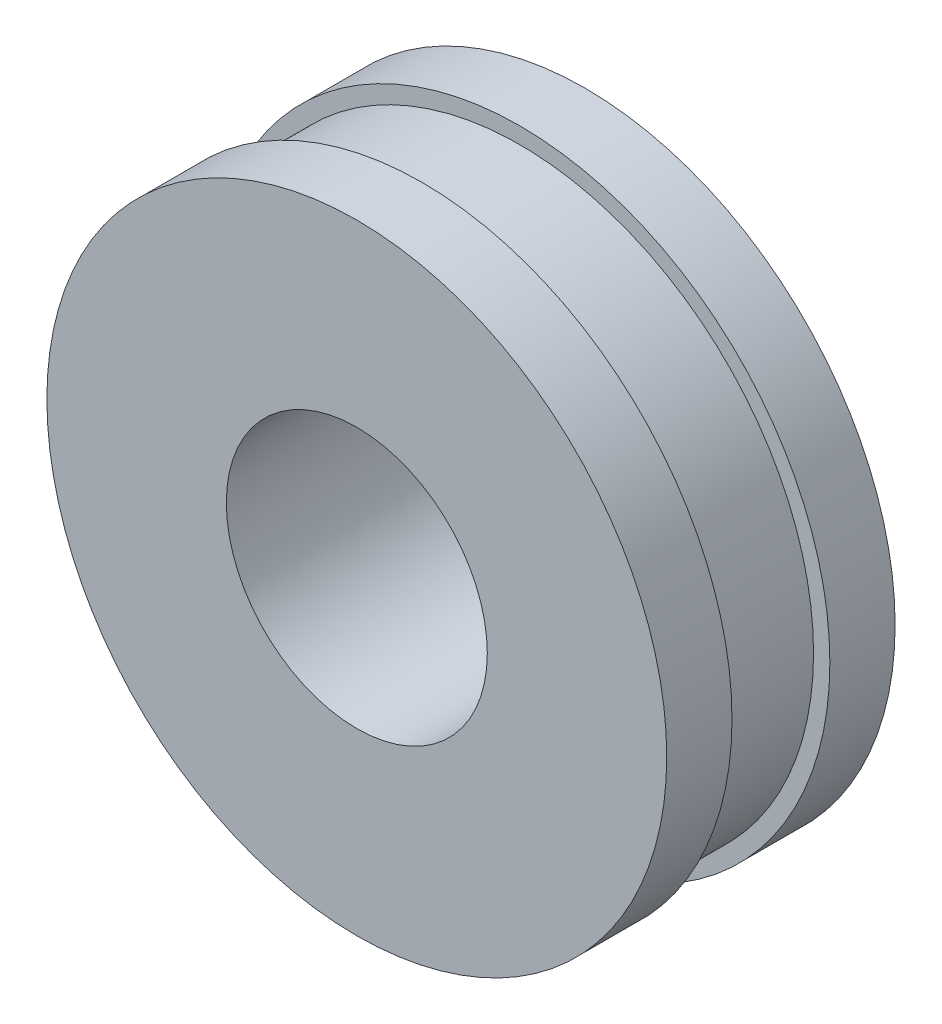
from build123d import *

# Parameters (mm, degrees)
SKETCH1_R           = 7.14375
SKETCH1_R_2         = 3.175
BOSS_EXTRUDE1_DEPTH = 2.38125
BOSS_EXTRUDE2_START = 1.5875
SKETCH2_R           = 7.540625
SKETCH2_R_2         = 3.175
BOSS_EXTRUDE2_DEPTH = 1.5875
SKETCH3_R           = 7.540625
SKETCH3_R_2         = 3.175
BOSS_EXTRUDE3_DEPTH = 1.5875


with BuildPart() as part:
    # Sketch1 → Boss-Extrude1 (new body)
    with BuildSketch(Plane.XY):
        with Locations(Location((0, 0, 0), (0, 0, 180))):
            Circle(SKETCH1_R)
        with Locations(Location((0, 0, 0), (0, 0, 180))):
            Circle(SKETCH1_R_2, mode=Mode.SUBTRACT)
    extrude(amount=BOSS_EXTRUDE1_DEPTH)

    # Sketch2 → Boss-Extrude2 (add)
    with BuildSketch(Plane(origin=(0, 0, 0), x_dir=(-1, 0, 0), z_dir=(0, 0, -1)).offset(BOSS_EXTRUDE2_START)):
        Circle(SKETCH2_R)
        Circle(SKETCH2_R_2, mode=Mode.SUBTRACT)
    extrude(amount=-BOSS_EXTRUDE2_DEPTH)

    # Sketch3 → Boss-Extrude3 (add)
    with BuildSketch(Plane.XY.offset(2.38125)):
        with Locations(Location((0, 0, 0), (0, 0, 180))):
            Circle(SKETCH3_R)
        with Locations(Location((0, 0, 0), (0, 0, 180))):
            Circle(SKETCH3_R_2, mode=Mode.SUBTRACT)
    extrude(amount=BOSS_EXTRUDE3_DEPTH)


solid = part.part
